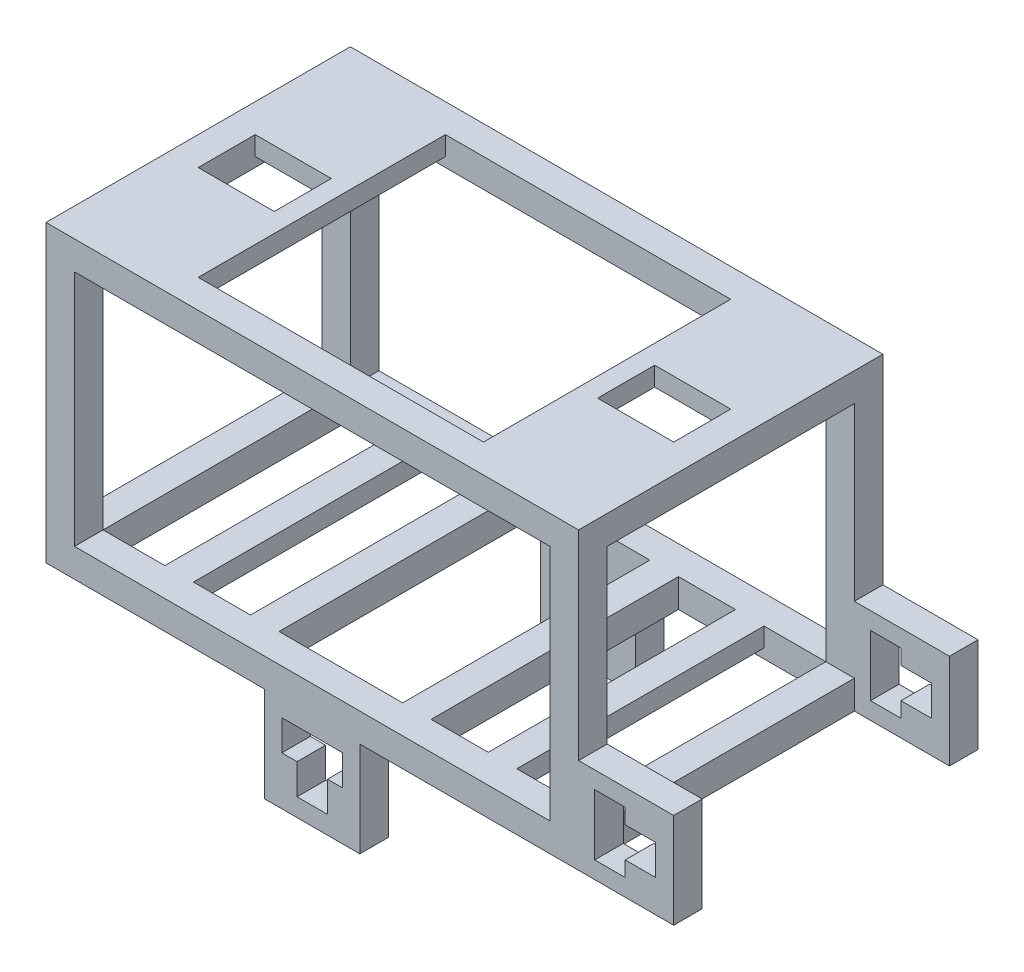
from build123d import *

# Parameters (mm, degrees)
SKETCH1_W           = 56
SKETCH1_H           = 32
SKETCH1_W_2         = 50
SKETCH1_H_2         = 26
BOSS_EXTRUDE1_DEPTH = 3
SKETCH2_W           = 3
SKETCH2_H           = 3
BOSS_EXTRUDE2_DEPTH = 28
SKETCH3_W           = 10
SKETCH3_H           = 10
BOSS_EXTRUDE3_DEPTH = 3
BOSS_EXTRUDE4_DEPTH = 3
SKETCH6_W           = 56
SKETCH6_H           = 32
SKETCH6_W_2         = 50
SKETCH6_H_2         = 26
BOSS_EXTRUDE5_DEPTH = 3
SKETCH10_W          = 3
SKETCH10_H          = 26
BOSS_EXTRUDE7_DEPTH = 3
SKETCH10_4_W        = 3
SKETCH10_4_H        = 26
BOSS_EXTRUDE8_DEPTH = 2
BOSS_EXTRUDE9_DEPTH = 2


with BuildPart() as part:
    # Sketch1 → Boss-Extrude1 (new body)
    with BuildSketch(Plane(origin=(0, 0, 0), x_dir=(1, 0, 0), z_dir=(0, 1, 0))):
        Rectangle(SKETCH1_W, SKETCH1_H)
        Rectangle(SKETCH1_W_2, SKETCH1_H_2, mode=Mode.SUBTRACT)
    extrude(amount=BOSS_EXTRUDE1_DEPTH)

    # Sketch2 → Boss-Extrude2 (add)
    with BuildSketch(Plane(origin=(0, 0, 0), x_dir=(1, 0, 0), z_dir=(0, 1, 0))):
        with Locations((26.5, 14.5)):
            Rectangle(SKETCH2_W, SKETCH2_H)
        with Locations((26.5, -14.5)):
            Rectangle(SKETCH2_W, SKETCH2_H)
        with Locations((-26.5, -14.5)):
            Rectangle(SKETCH2_W, SKETCH2_H)
        with Locations((-26.5, 14.5)):
            Rectangle(SKETCH2_W, SKETCH2_H)
    extrude(amount=BOSS_EXTRUDE2_DEPTH)

    # Sketch3 → Boss-Extrude3 (add)
    with BuildSketch(Plane.XY.offset(16)):
        with Locations((33, 5)):
            Rectangle(SKETCH3_W, SKETCH3_H)
        Polygon((29.7, 1.8), (29.7, 8.2), (32.9, 8.2), (32.9, 6.6), (36.1, 6.6), (36.1, 3.4), (32.9, 3.4), (32.9, 1.8), align=None, mode=Mode.SUBTRACT)
    boss_extrude3 = extrude(amount=-BOSS_EXTRUDE3_DEPTH)

    # Mirror1: Boss-Extrude3 across plane
    add(boss_extrude3.mirror(Plane.XY))

    # Sketch4 → Boss-Extrude4 (add)
    with BuildSketch(Plane.XY.offset(16)):
        Polygon((5, 0), (0, 0), (-5, 0), (-5, -10), (0, -10), (5, -10), align=None)
        Polygon((1.6, -8.1), (0, -8.1), (-1.6, -8.1), (-1.6, -4.9), (-3.2, -4.9), (-3.2, -1.7), (3.2, -1.7), (3.2, -4.9), (1.6, -4.9), align=None, mode=Mode.SUBTRACT)
    boss_extrude4 = extrude(amount=-BOSS_EXTRUDE4_DEPTH)

    # Mirror2: Boss-Extrude4 across plane
    add(boss_extrude4.mirror(Plane.XY))

    # Sketch6 → Boss-Extrude5 (add)
    with BuildSketch(Plane(origin=(0, 28, 0), x_dir=(1, 0, 0), z_dir=(0, 1, 0))):
        Rectangle(SKETCH6_W, SKETCH6_H)
        Rectangle(SKETCH6_W_2, SKETCH6_H_2, mode=Mode.SUBTRACT)
    extrude(amount=BOSS_EXTRUDE5_DEPTH)

    # Sketch10 → Boss-Extrude7 (add)
    with BuildSketch(Plane(origin=(0, 3, 0), x_dir=(1, 0, 0), z_dir=(0, 1, 0))):
        with Locations((-8, 0)):
            Rectangle(SKETCH10_W, SKETCH10_H)
        with Locations((8, 0)):
            Rectangle(SKETCH10_W, SKETCH10_H)
    extrude(amount=-BOSS_EXTRUDE7_DEPTH)

    # Sketch10<4> → Boss-Extrude8 (add)
    with BuildSketch(Plane(origin=(0, 3, 0), x_dir=(1, 0, 0), z_dir=(0, 1, 0))):
        with Locations((-17, 0)):
            Rectangle(SKETCH10_4_W, SKETCH10_4_H)
        with Locations((17, 0)):
            Rectangle(SKETCH10_4_W, SKETCH10_4_H)
    extrude(amount=-BOSS_EXTRUDE8_DEPTH)

    # Sketch11 → Boss-Extrude9 (add)
    with BuildSketch(Plane(origin=(0, 31, 0), x_dir=(1, 0, 0), z_dir=(0, 1, 0))):
        Polygon((-25, -3), (-25, -13), (-15, -13), (-15, 13), (-25, 13), (-25, 3), (-17, 3), (-17, -3), align=None)
        Polygon((15, -13), (25, -13), (25, -3), (17, -3), (17, 3), (25, 3), (25, 13), (15, 13), align=None)
    extrude(amount=-BOSS_EXTRUDE9_DEPTH)


solid = part.part
